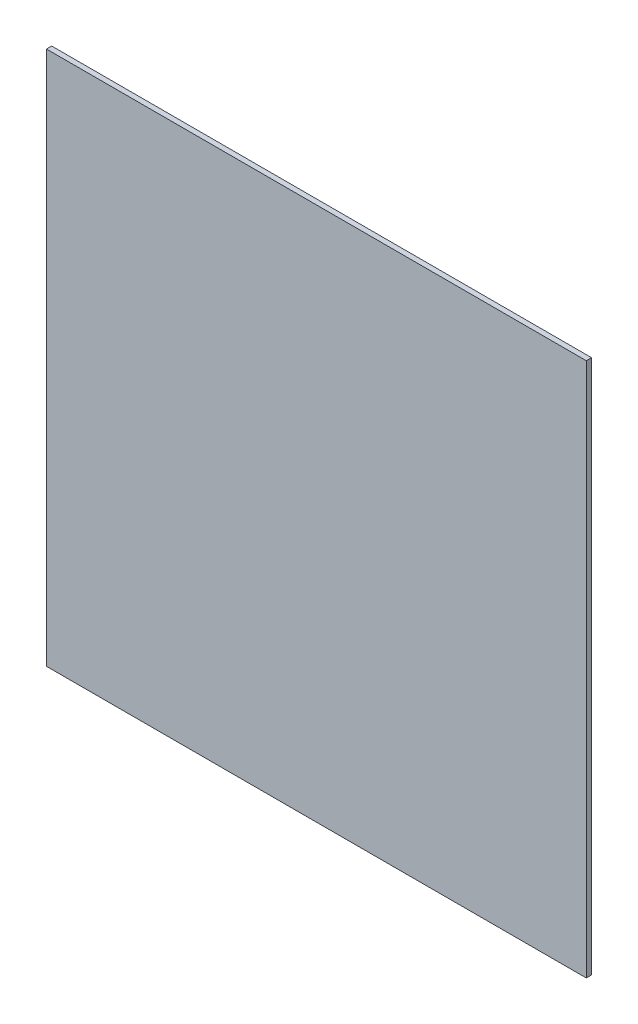
from build123d import *

# Parameters (mm, degrees)
SKETCH_1_W      = 103
SKETCH_1_H      = 102
EXTRUDE_1_DEPTH = 1


with BuildPart() as part:
    # 草图1 → 凸台-拉伸1 (new body)
    with BuildSketch(Plane.XY):
        with Locations((-51.5, 51)):
            Rectangle(SKETCH_1_W, SKETCH_1_H)
    extrude(amount=EXTRUDE_1_DEPTH)


solid = part.part
